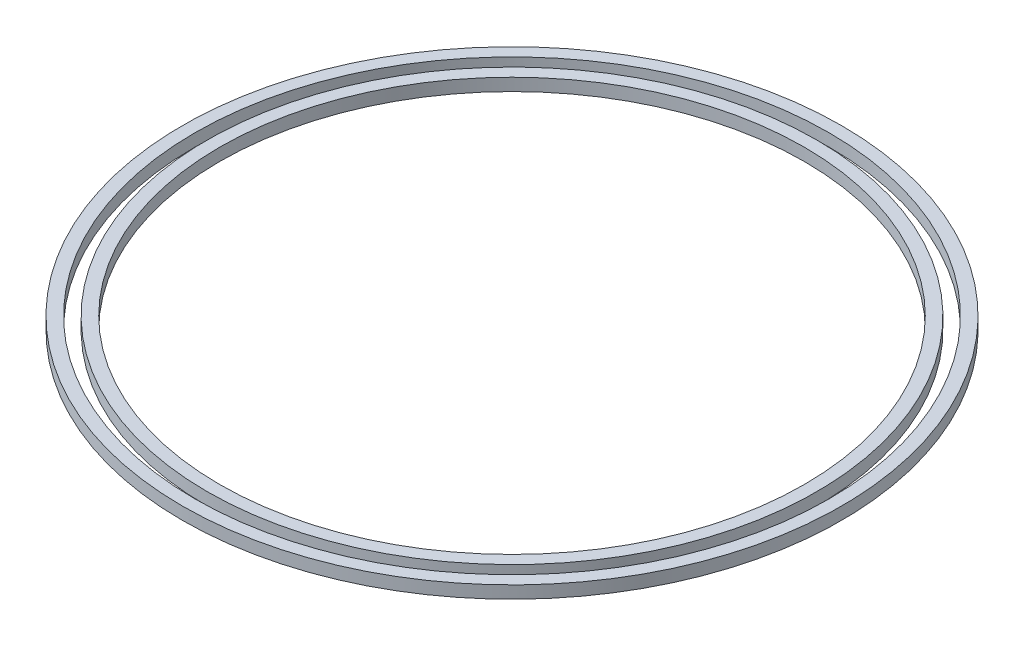
from build123d import *

# Parameters (mm, degrees)
SKETCH_2_R      = 2650
SKETCH_2_R_2    = 2550
EXTRUDE_1_DEPTH = 100
EXTRUDE_START   = -100
SKETCH_4_R      = 2450
SKETCH_4_R_2    = 2350
EXTRUDE_3_DEPTH = 100


with BuildPart() as part:
    # ｽｹｯﾁ2 → ﾎﾞｽ - 押し出し1 (new body)
    with BuildSketch(Plane(origin=(0, 0, 0), x_dir=(1, 0, 0), z_dir=(0, 1, 0))):
        with Locations(Location((0, 0, 0), (0, 0, 270))):
            Circle(SKETCH_2_R)
        with Locations(Location((0, 0, 0), (0, 0, 270))):
            Circle(SKETCH_2_R_2, mode=Mode.SUBTRACT)
    extrude(amount=EXTRUDE_1_DEPTH)


with BuildPart() as body_2:
    # ｽｹｯﾁ4 → ﾎﾞｽ - 押し出し3 (new body)
    with BuildSketch(Plane(origin=(0, 0, 0), x_dir=(-1, 0, 0), z_dir=(0, -1, 0)).offset(EXTRUDE_START)):
        with Locations(Location((0, 0, 0), (0, 0, 90))):
            Circle(SKETCH_4_R)
        with Locations(Location((0, 0, 0), (0, 0, 90))):
            Circle(SKETCH_4_R_2, mode=Mode.SUBTRACT)
    extrude(amount=EXTRUDE_3_DEPTH)


solid = Compound([part.part, body_2.part])
